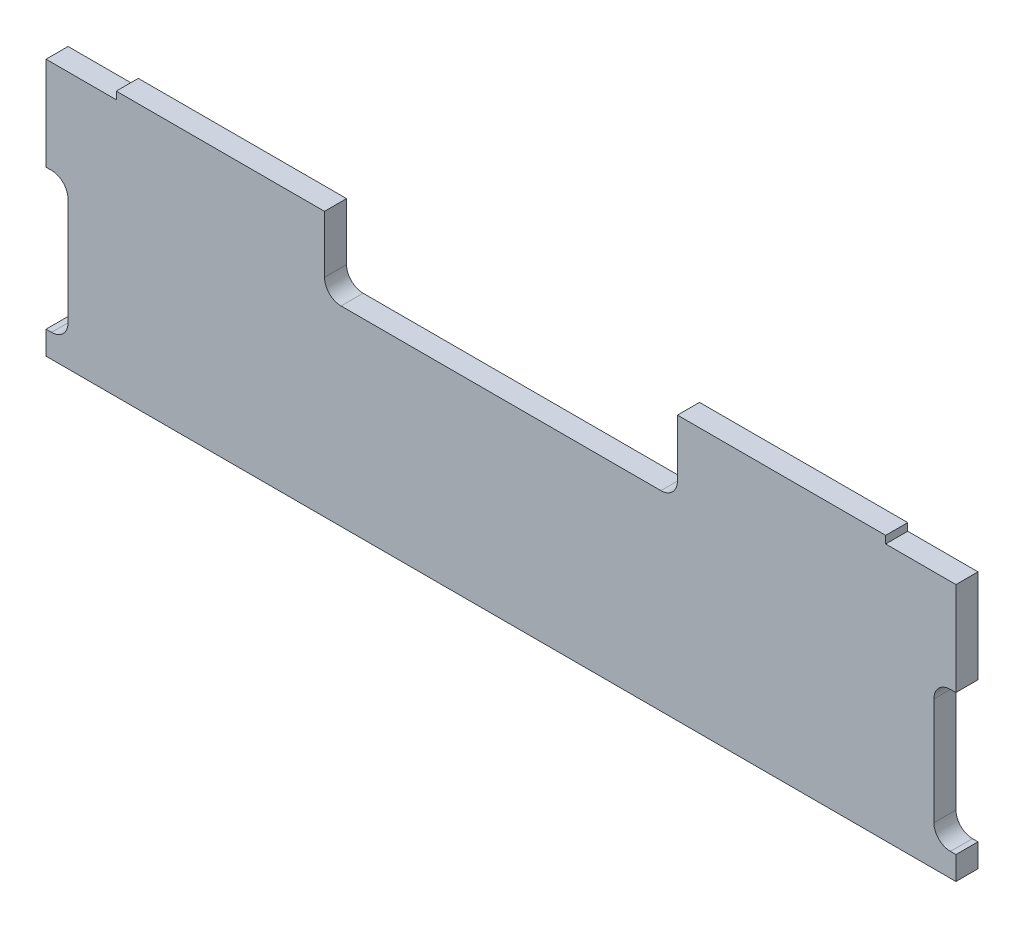
from build123d import *

# Parameters (mm, degrees)
SKETCH1_W           = 261.9375
SKETCH1_H           = 69.85
BOSS_EXTRUDE1_DEPTH = 6.35
SKETCH2_W           = 6.35
SKETCH2_H           = 38.1
CUT_EXTRUDE1_DEPTH  = 136.694110416
SCALE1_SCALE_X      = 1
SCALE1_SCALE_Y      = 1.06
SCALE1_SCALE_Z      = 1
SKETCH3_W           = 101.6
SKETCH3_H           = 19.05
CUT_EXTRUDE2_DEPTH  = 137.252717885
FILLET1_R           = 4.7625
SKETCH4_W           = 59.944
SKETCH4_H           = 2.159
BOSS_EXTRUDE2_DEPTH = 6.35


with BuildPart() as part:
    # Sketch1 → Boss-Extrude1 (new body)
    with BuildSketch(Plane.XY):
        Rectangle(SKETCH1_W, SKETCH1_H)
    extrude(amount=BOSS_EXTRUDE1_DEPTH)

    # Sketch2 → Cut-Extrude1 (cut, through all)
    with BuildSketch(Plane.XY.offset(6.35)):
        with Locations((-127.79375, -9.525)):
            Rectangle(SKETCH2_W, SKETCH2_H)
        with Locations((127.79375, -9.525)):
            Rectangle(SKETCH2_W, SKETCH2_H)
    extrude(amount=-CUT_EXTRUDE1_DEPTH, mode=Mode.SUBTRACT)


with BuildPart() as part_1:
    # Scale1: scaled about (0, 0.258743633, 3.175)
    add(part.part.scale((SCALE1_SCALE_X, SCALE1_SCALE_Y, SCALE1_SCALE_Z), about=(0, 0.258743633, 3.175)))

    # Sketch3 → Cut-Extrude2 (cut, through all)
    with BuildSketch(Plane.XY.offset(6.35)):
        with Locations((0, 27.479975382)):
            Rectangle(SKETCH3_W, SKETCH3_H)
    extrude(amount=-CUT_EXTRUDE2_DEPTH, mode=Mode.SUBTRACT)

    # Fillet1
    fillet1_edges = [part_1.edges().sort_by_distance(p)[0] for p in [
        (-124.61875, 10.080975382, 3.175),
        (-124.61875, -30.305024618, 3.175),
        (124.61875, -30.305024618, 3.175),
        (124.61875, 10.080975382, 3.175),
        (-50.8, 17.954975382, 3.175),
        (50.8, 17.954975382, 3.175),
    ]]
    fillet(fillet1_edges, radius=FILLET1_R)

    # Sketch4 → Boss-Extrude2 (add)
    with BuildSketch(Plane.XY.offset(6.35)):
        with Locations((-80.772, 38.084475382)):
            Rectangle(SKETCH4_W, SKETCH4_H)
        with Locations((80.772, 38.084475382)):
            Rectangle(SKETCH4_W, SKETCH4_H)
    extrude(amount=-BOSS_EXTRUDE2_DEPTH)


solid = part_1.part
